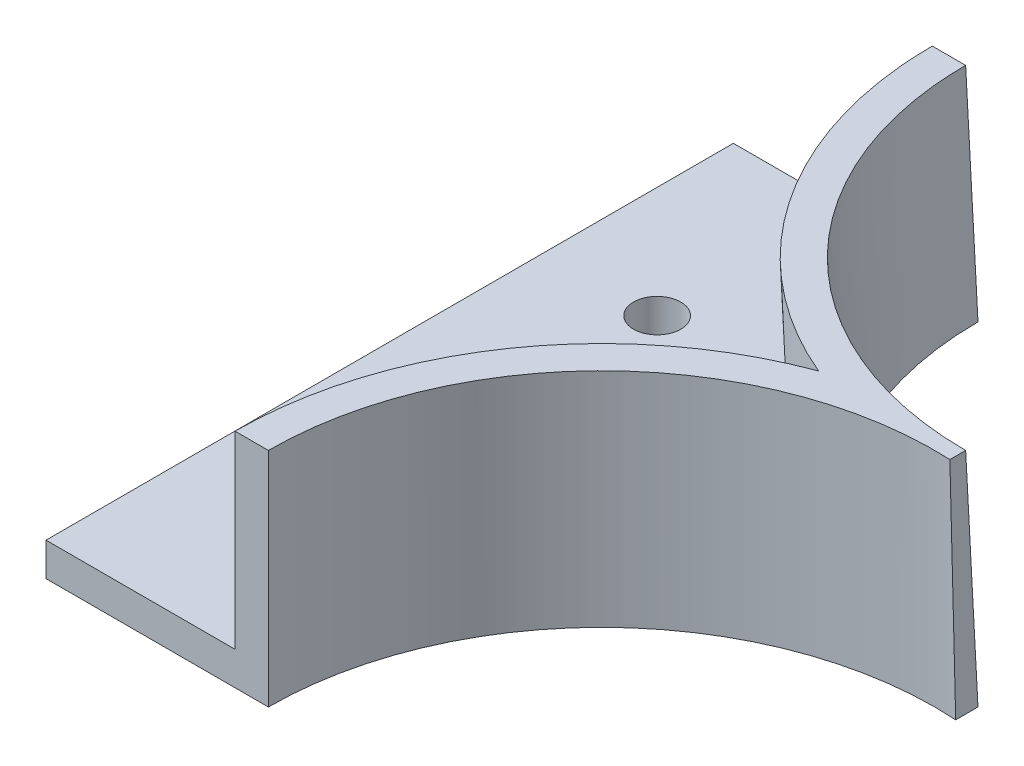
from build123d import *

# Parameters (mm, degrees)
SKETCH_1_W               = 50
SKETCH_1_H               = 60
EXTRUDE_1_DEPTH          = 70
DRAFT_1_ANGLE            = 1.591
CUT_EXTRUDE_1_DEPTH      = 105.880884817
CUT_EXTRUDE_1_DEPTH_BACK = 105.880884817
SKETCH_8_R               = 30
SKETCH_9_R               = 29.988439116
CUT_EXTRUDE_2_DEPTH      = 93.836652593
SKETCH_10_W              = 61.388766385
SKETCH_10_H              = 50
CUT_EXTRUDE_3_DEPTH      = 93.836652759
SHELL_1_T                = -3
SKETCH_11_R              = 2.125
CUT_EXTRUDE_4_DEPTH      = 64.305956024


with BuildPart() as part:
    # 草圖1 → 填料-伸長1 (new body)
    with BuildSketch(Plane(origin=(0, 0, 0), x_dir=(1, 0, 0), z_dir=(0, 1, 0))):
        with Locations((25, 0)):
            Rectangle(SKETCH_1_W, SKETCH_1_H)
    extrude(amount=EXTRUDE_1_DEPTH)

    # 拔模1
    draft_1_faces = [part.faces().sort_by_distance(p)[0] for p in [
        (50, 35, 0),
        (25, 35, -30),
    ]]
    draft(draft_1_faces, Plane.ZX.offset(70), DRAFT_1_ANGLE)

    # 草圖8 → 除料-伸長1 (cut, two sides: drawn at the far end of the back side and taken through both)
    with BuildSketch(Plane(origin=(50, 70, -30), x_dir=(0.9996147856379402, 0.027743225206125616, 0.0007705771714084014), z_dir=(0.027753924659674706, -0.9992294227713525, -0.027753924659674706)).offset(-CUT_EXTRUDE_1_DEPTH_BACK)):
        Circle(SKETCH_8_R)
    extrude(amount=CUT_EXTRUDE_1_DEPTH + CUT_EXTRUDE_1_DEPTH_BACK, mode=Mode.SUBTRACT)

    # 草圖9 → 除料-伸長2 (cut, through all)
    with BuildSketch(Plane(origin=(0, 70, 0), x_dir=(1, 0, 0), z_dir=(0, 1, 0))):
        with Locations((50, -30)):
            Circle(SKETCH_9_R)
    extrude(amount=-CUT_EXTRUDE_2_DEPTH, mode=Mode.SUBTRACT)

    # 草圖10 → 除料-伸長3 (cut, through all)
    with BuildSketch(Plane.ZY):
        with Locations((-0.694383192, 45)):
            Rectangle(SKETCH_10_W, SKETCH_10_H)
    extrude(amount=-CUT_EXTRUDE_3_DEPTH, mode=Mode.SUBTRACT)

    # 薄殼1
    shell_1_openings = [part.faces().sort_by_distance(p)[0] for p in [
        (14.872442298, 20, -1.069608967),
        (10.828073147, 9.957245624, -31.667707178),
        (10.005780442, 10, 30),
        (0, 9.984986274, -0.833468336),
    ]]
    offset(amount=SHELL_1_T, openings=shell_1_openings, kind=Kind.INTERSECTION)

    # 草圖11 → 除料-伸長4 (cut, through all)
    with BuildSketch(Plane(origin=(0, 3, 0), x_dir=(1, 0, 0), z_dir=(0, 1, 0))):
        with Locations(Location((10, 15, 0), (0, 0, 270))):
            Circle(SKETCH_11_R)
        with Locations(Location((10, -15, 0), (0, 0, 90))):
            Circle(SKETCH_11_R)
    extrude(amount=-CUT_EXTRUDE_4_DEPTH, mode=Mode.SUBTRACT)


solid = part.part
